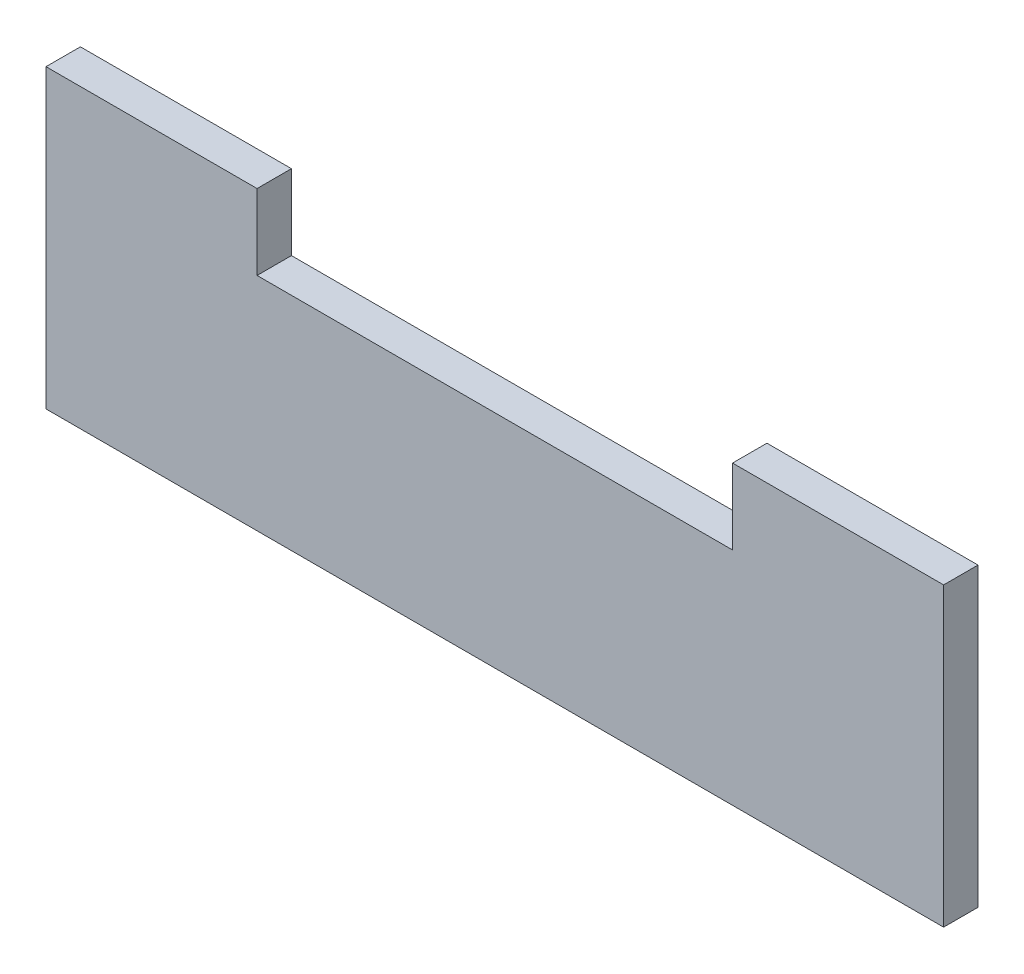
from build123d import *

# Parameters (mm, degrees)
BOSS_EXTRUDE1_DEPTH = 2.9


with BuildPart() as part:
    # Sketch1 → Boss-Extrude1 (new body)
    with BuildSketch(Plane.XY):
        Polygon((-37.85, 0), (37.85, 0), (37.85, 25), (20.05, 25), (20.05, 18.65), (-20.05, 18.65), (-20.05, 25), (-37.85, 25), align=None)
    extrude(amount=BOSS_EXTRUDE1_DEPTH)


solid = part.part
